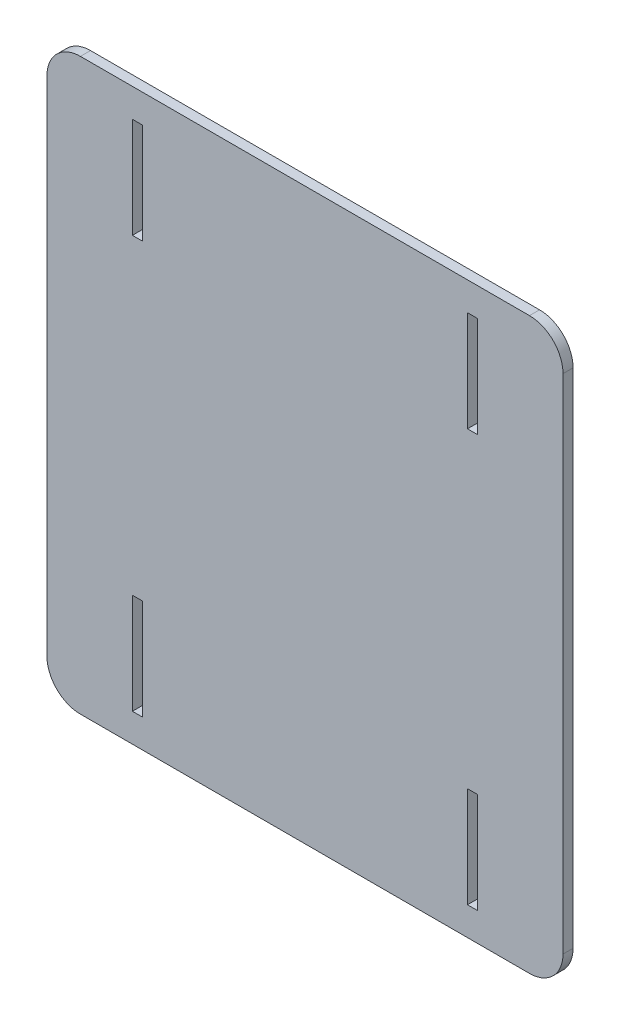
from build123d import *

# Parameters (mm, degrees)
ESBO_O1_W                = 154
ESBO_O1_H                = 170
RESSALTO_EXTRUS_O1_DEPTH = 3
FILETE1_R                = 10
ESBO_O2_W                = 3
ESBO_O2_H                = 30
CORTE_EXTRUS_O1_DEPTH    = 115.730118103


with BuildPart() as part:
    # Esboço1 → Ressalto-extrusão1 (new body)
    with BuildSketch(Plane.XY):
        Rectangle(ESBO_O1_W, ESBO_O1_H)
    extrude(amount=RESSALTO_EXTRUS_O1_DEPTH)

    # Filete1
    filete1_edges = [part.edges().sort_by_distance(p)[0] for p in [
        (77, -85, 1.5),
        (-77, -85, 1.5),
        (-77, 85, 1.5),
        (77, 85, 1.5),
    ]]
    fillet(filete1_edges, radius=FILETE1_R)

    # Esboço2 → Corte-extrusão1 (cut, through all)
    with BuildSketch(Plane.XY.offset(3)):
        with Locations((-50, 61.5)):
            Rectangle(ESBO_O2_W, ESBO_O2_H)
        with Locations((50, 61.5)):
            Rectangle(ESBO_O2_W, ESBO_O2_H)
        with Locations((50, -61.5)):
            Rectangle(ESBO_O2_W, ESBO_O2_H)
        with Locations((-50, -61.5)):
            Rectangle(ESBO_O2_W, ESBO_O2_H)
    extrude(amount=-CORTE_EXTRUS_O1_DEPTH, mode=Mode.SUBTRACT)


solid = part.part
